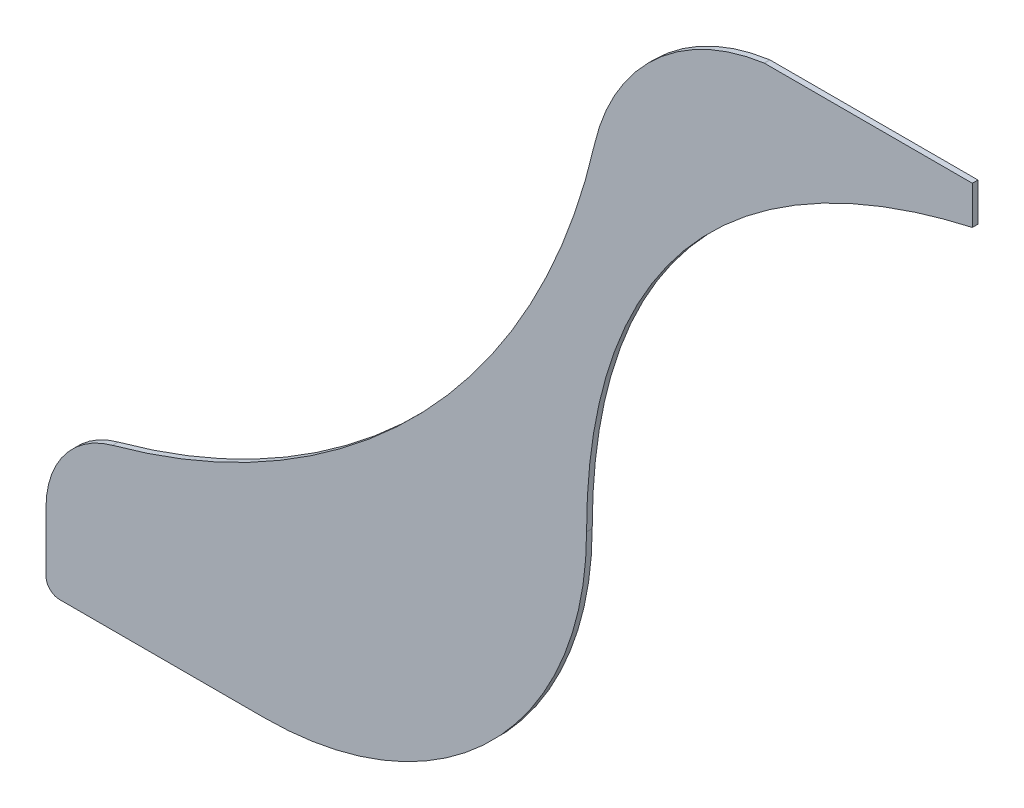
from build123d import *

# Parameters (mm, degrees)
BOSS_EXTRUDE1_DEPTH = 3.175


with BuildPart() as part:
    # Sketch1 → Boss-Extrude1 (new body)
    with BuildSketch(Plane.XY):
        with BuildLine():
            Line((771.903793001, 164.465805668), (771.903793001, 186.055805664))
            Line((771.903793001, 186.055805664), (654.555793001, 186.055805664))
            ThreePointArc((654.555793001, 186.055805664), (593.014276043, 157.121992999), (558.8, 98.352042006))
            ThreePointArc((558.8, 98.352042006), (462.094129135, -80.619143391), (287.082829619, -184.319460189))
            ThreePointArc((287.082829619, -184.319460189), (260.024944938, -202.483344486), (249.571639661, -233.350547549))
            Line((249.571639661, -233.350547549), (249.571639661, -266.960111933))
            ThreePointArc((249.571639661, -266.960111933), (251.803485989, -272.348265606), (257.191639661, -274.580111933))
            Line((257.191639661, -274.580111933), (372.702998231, -274.580111933))
            ThreePointArc((372.702998231, -274.580111933), (501.162126515, -221.370598787), (554.371639661, -92.911470503))
            add(Edge.make_bspline(
                [(554.371639661, -92.911470503), (554.371639661, 52.307938416), (646.172603674, 136.193906474), (771.903793001, 164.465805668)],
                knots=[0, 0, 0, 0, 1, 1, 1, 1], degree=3))
        make_face()
    extrude(amount=BOSS_EXTRUDE1_DEPTH)


solid = part.part
